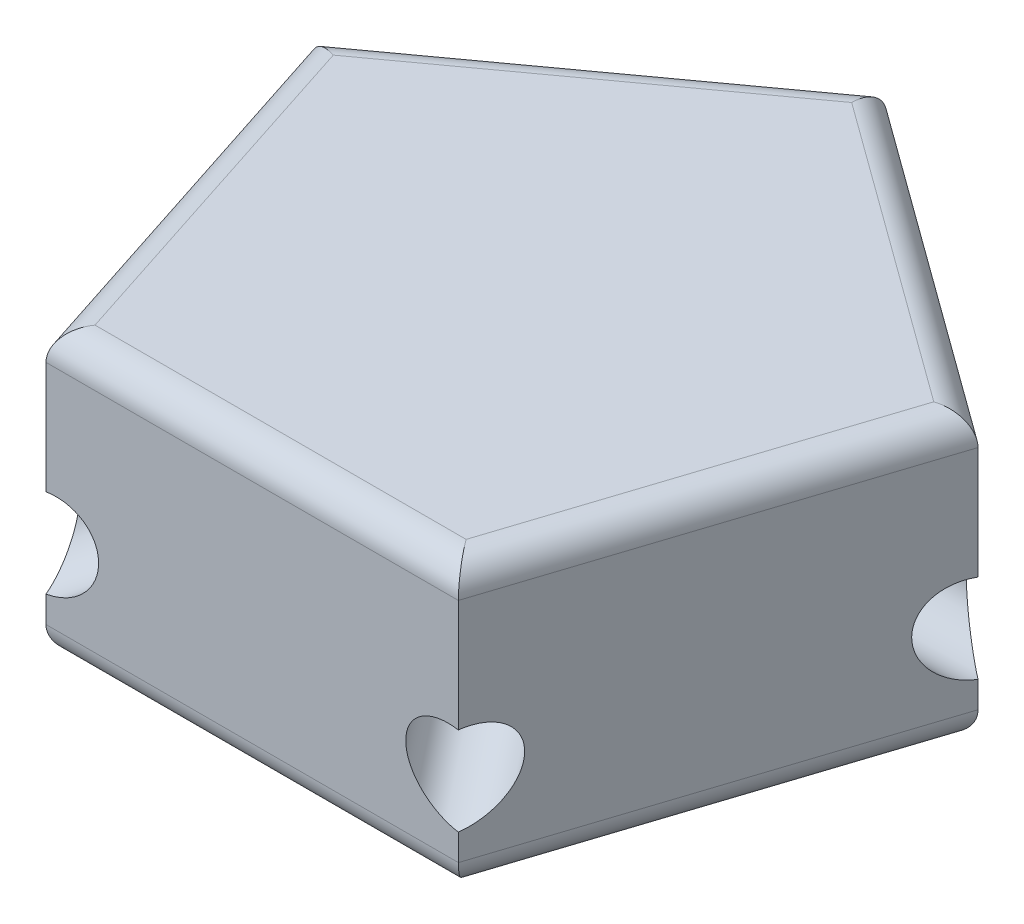
from build123d import *

# Parameters (mm, degrees)
BOSS_EXTRUDE1_DEPTH      = 3
BOSS_EXTRUDE1_DEPTH_BACK = 7
FILLET1_R                = 1
SKETCH2_R                = 1.5
CUT_EXTRUDE1_DEPTH       = 22.698151839
CIRPATTERN1_COUNT        = 5


with BuildPart() as part:
    # Sketch1 → Boss-Extrude1 (new, two sides: drawn at the far end of the back side and taken through both)
    with BuildSketch(Plane(origin=(0, 0, 0), x_dir=(1, 0, 0), z_dir=(0, 1, 0)).offset(-BOSS_EXTRUDE1_DEPTH_BACK)):
        Polygon((-7.26542528, -10), (7.26542528, -10), (11.755705046, 3.819660113), (0, 12.360679775), (-11.755705046, 3.819660113), align=None)
    extrude(amount=BOSS_EXTRUDE1_DEPTH + BOSS_EXTRUDE1_DEPTH_BACK)

    # Fillet1
    fillet1_edges = [part.edges().sort_by_distance(p)[0] for p in [
        (0, -7, 10),
        (9.510565163, -7, 3.090169944),
        (5.877852523, -7, -8.090169944),
        (-5.877852523, -7, -8.090169944),
        (-9.510565163, -7, 3.090169944),
        (-5.877852523, 3, -8.090169944),
        (5.877852523, 3, -8.090169944),
        (9.510565163, 3, 3.090169944),
        (0, 3, 10),
        (-9.510565163, 3, 3.090169944),
    ]]
    fillet(fillet1_edges, radius=FILLET1_R)

    # Sketch2 → Cut-Extrude1 (cut, through all)
    with BuildSketch(Plane(origin=(-2.261652721, -1.093066116, 3.112897916), x_dir=(-0.824807817325119, 0.18732666439624865, -0.533479882737436), z_dir=(0.56541318031982, 0.2732665289126595, -0.7782244789883274))):
        Circle(SKETCH2_R)
    cut_extrude1 = extrude(amount=-CUT_EXTRUDE1_DEPTH, mode=Mode.SUBTRACT)

    # CirPattern1: Cut-Extrude1 ×5 about axis
    cirpattern1_axis = Axis((0, 5.5, 0), (0, -1, 0))
    for i in range(1, CIRPATTERN1_COUNT):
        add(cut_extrude1.rotate(cirpattern1_axis, i * 360 / CIRPATTERN1_COUNT), mode=Mode.SUBTRACT)


solid = part.part
